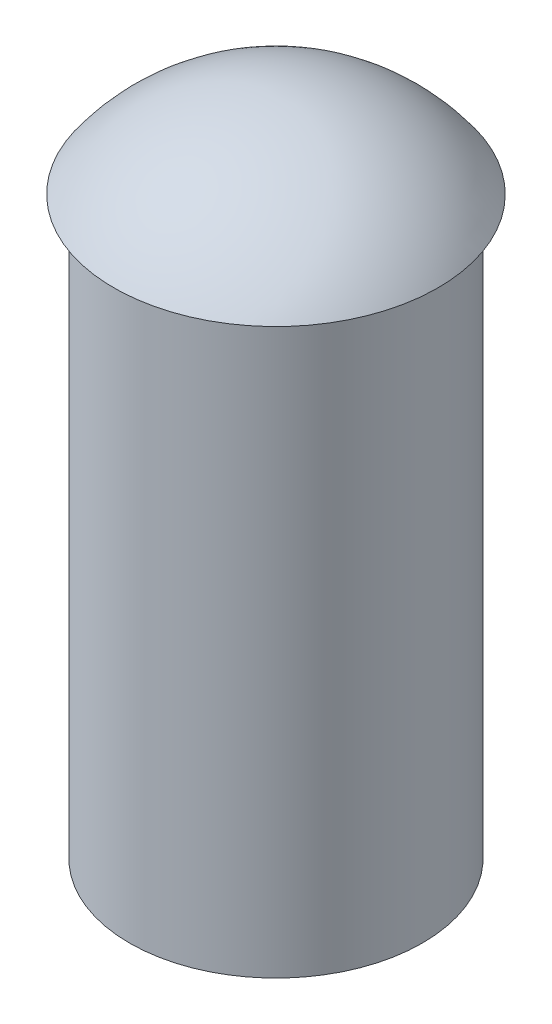
from build123d import *

# Parameters (mm, degrees)
SKETCH2_R           = 1.4
BOSS_EXTRUDE1_DEPTH = 5.5


with BuildPart() as part:
    # Sketch2 → Boss-Extrude1 (new body)
    with BuildSketch(Plane(origin=(0, 0, 0), x_dir=(1, 0, 0), z_dir=(0, 1, 0))):
        with Locations(Location((0, 0, 0), (0, 0, 270))):
            Circle(SKETCH2_R)
    extrude(amount=-BOSS_EXTRUDE1_DEPTH)

    # Sketch4 → Revolve1 (revolve)
    with BuildSketch(Plane(origin=(0, 0, 0), x_dir=(0, 0, -1), z_dir=(1, 0, 0)), mode=Mode.PRIVATE) as revolve1_sk:
        with BuildLine():
            Line((0, 0), (-1.55, 0))
            ThreePointArc((-1.55, 0), (-0.872138177, 0.588205218), (0, 0.8))
            Line((0, 0.8), (0, 0))
        make_face()
    revolve(revolve1_sk.sketch.rotate(Axis((0, 0, 0), (0, 1, 0)), 180), axis=Axis((0, 0, 0), (0, 1, 0)))


solid = part.part
